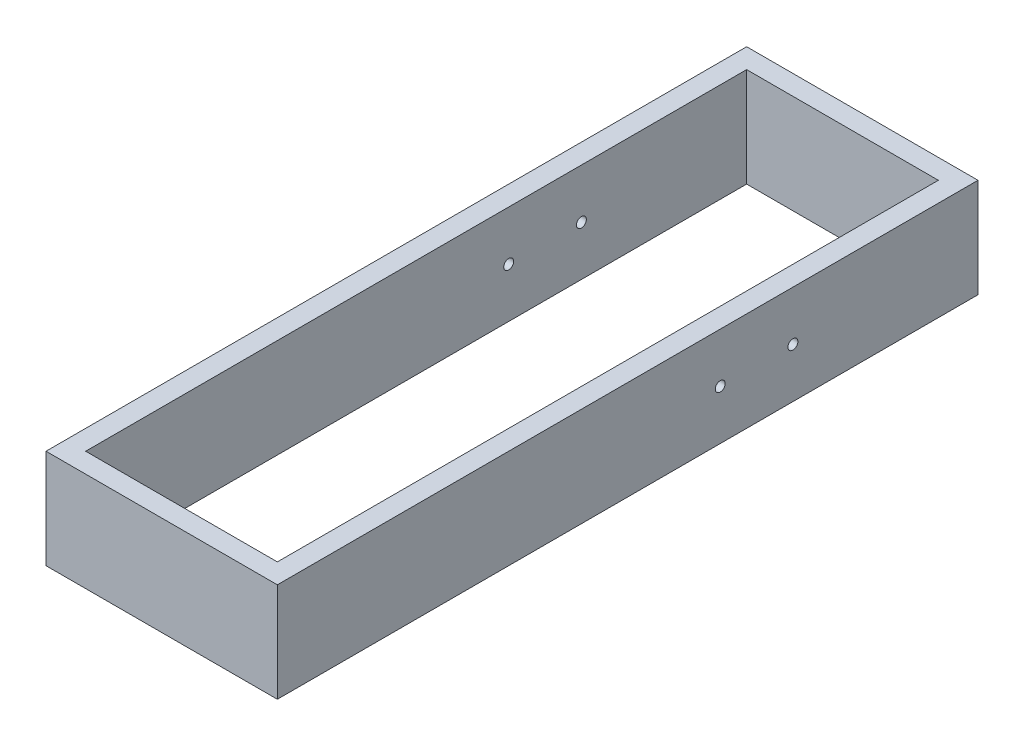
from build123d import *

# Parameters (mm, degrees)
SKETCH1_W           = 70
SKETCH1_H           = 212
SKETCH1_W_2         = 58
SKETCH1_H_2         = 200
BOSS_EXTRUDE1_DEPTH = 30
SKETCH2_R           = 1.5
CUT_EXTRUDE1_DEPTH  = 131.522028792


with BuildPart() as part:
    # Sketch1 → Boss-Extrude1 (new body)
    with BuildSketch(Plane(origin=(0, 0, 0), x_dir=(1, 0, 0), z_dir=(0, 1, 0))):
        Rectangle(SKETCH1_W, SKETCH1_H)
        Rectangle(SKETCH1_W_2, SKETCH1_H_2, mode=Mode.SUBTRACT)
    extrude(amount=BOSS_EXTRUDE1_DEPTH)

    # Sketch2 → Cut-Extrude1 (cut, through all)
    with BuildSketch(Plane(origin=(35, 0, 0), x_dir=(0, 0, -1), z_dir=(1, 0, 0))):
        with Locations((50, 15)):
            Circle(SKETCH2_R)
        with Locations((28, 15)):
            Circle(SKETCH2_R)
    extrude(amount=-CUT_EXTRUDE1_DEPTH, mode=Mode.SUBTRACT)


solid = part.part
